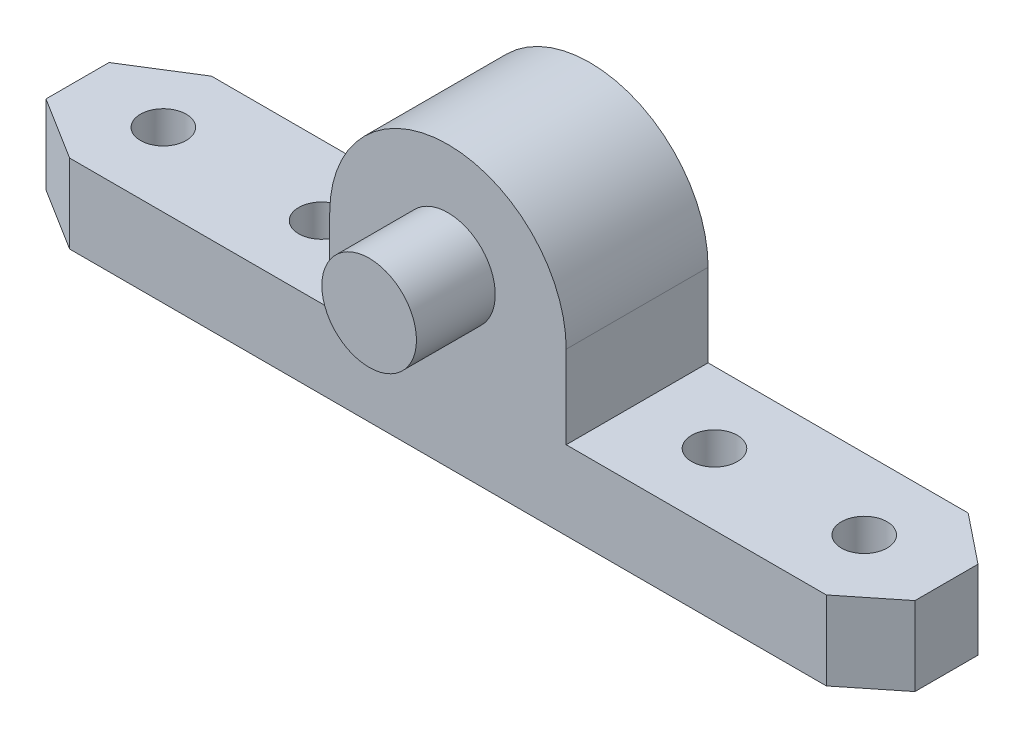
from build123d import *

# Parameters (mm, degrees)
DODANIE_WYCI_GNI_CIE1_DEPTH = 5
DODANIE_WYCI_GNI_CIE2_DEPTH = 9
SZKIC4_R                    = 1.45
WYTNIJ_WYCI_GNI_CIE1_DEPTH  = 6
SZKIC3_R                    = 3
DODANIE_WYCI_GNI_CIE3_DEPTH = 5


with BuildPart() as part:
    # Szkic1 → Dodanie-wyciągnięcie1 (new body)
    with BuildSketch(Plane(origin=(0, 0, 0), x_dir=(1, 0, 0), z_dir=(0, 1, 0))):
        Polygon((24, 4.5), (27.122498999, 2), (27.122498999, -2), (24, -4.5), (-24, -4.5), (-28, -2), (-28, 2), (-24, 4.5), align=None)
    extrude(amount=DODANIE_WYCI_GNI_CIE1_DEPTH)

    # Szkic2 → Dodanie-wyciągnięcie2 (add)
    with BuildSketch(Plane.XY.offset(4.5)):
        with BuildLine():
            Line((-7.5, 5), (7.5, 5))
            Line((7.5, 5), (7.5, 10.25))
            ThreePointArc((7.5, 10.25), (0, 17.75), (-7.5, 10.25))
            Line((-7.5, 10.25), (-7.5, 5))
        make_face()
    extrude(amount=-DODANIE_WYCI_GNI_CIE2_DEPTH)

    # Szkic4 → Wytnij-wyciągnięcie1 (cut)
    with BuildSketch(Plane(origin=(0, 5, 0), x_dir=(1, 0, 0), z_dir=(0, 1, 0))):
        with Locations(Location((12.40562475, 0, 0), (0, 0, 270))):
            Circle(SZKIC4_R)
        with Locations(Location((21.90562475, 0, 0), (0, 0, 270))):
            Circle(SZKIC4_R)
        with Locations(Location((-12.57201541, 0.053033314, 0), (0, 0, 270))):
            Circle(SZKIC4_R)
        with Locations(Location((-22.71604623, 0.159099943, 0), (0, 0, 270))):
            Circle(SZKIC4_R)
    extrude(amount=-WYTNIJ_WYCI_GNI_CIE1_DEPTH, mode=Mode.SUBTRACT)

    # Szkic3 → Dodanie-wyciągnięcie3 (add)
    with BuildSketch(Plane.XY.offset(4.5)):
        with Locations(Location((0, 11, 0), (0, 0, 180))):
            Circle(SZKIC3_R)
    extrude(amount=DODANIE_WYCI_GNI_CIE3_DEPTH)


solid = part.part
